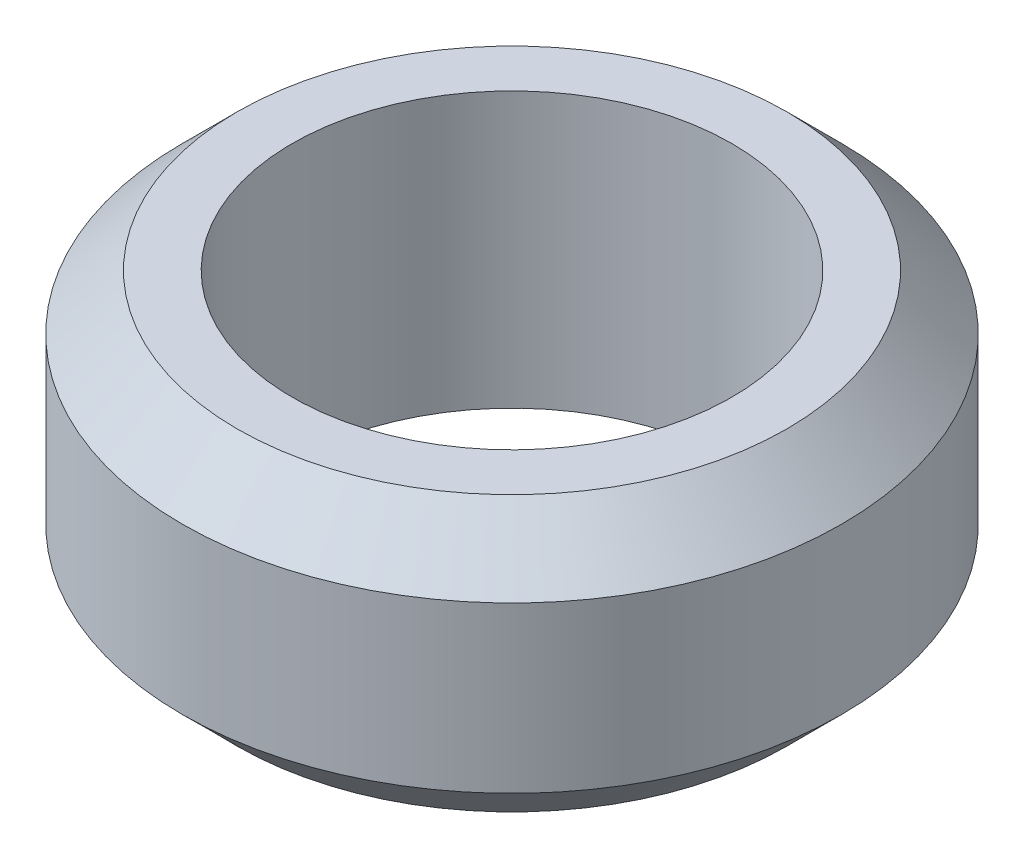
from build123d import *


with BuildPart() as part:
    # Sketch1 → Revolve2 (revolve)
    with BuildSketch(Plane.XY, mode=Mode.PRIVATE) as revolve2_sk:
        Polygon((8, 5), (8, 0), (12, 0), (12, 3), (10, 5), align=None)
    revolve2 = revolve(revolve2_sk.sketch.rotate(Axis((0, 0, 0), (0, 1, 0)), 90), axis=Axis((0, 0, 0), (0, 1, 0)))

    # Mirror1: Revolve2 across plane
    add(revolve2.mirror(Plane(origin=(0, 0, 0), x_dir=(0, 0, 1), z_dir=(0, -1, 0))))


solid = part.part
